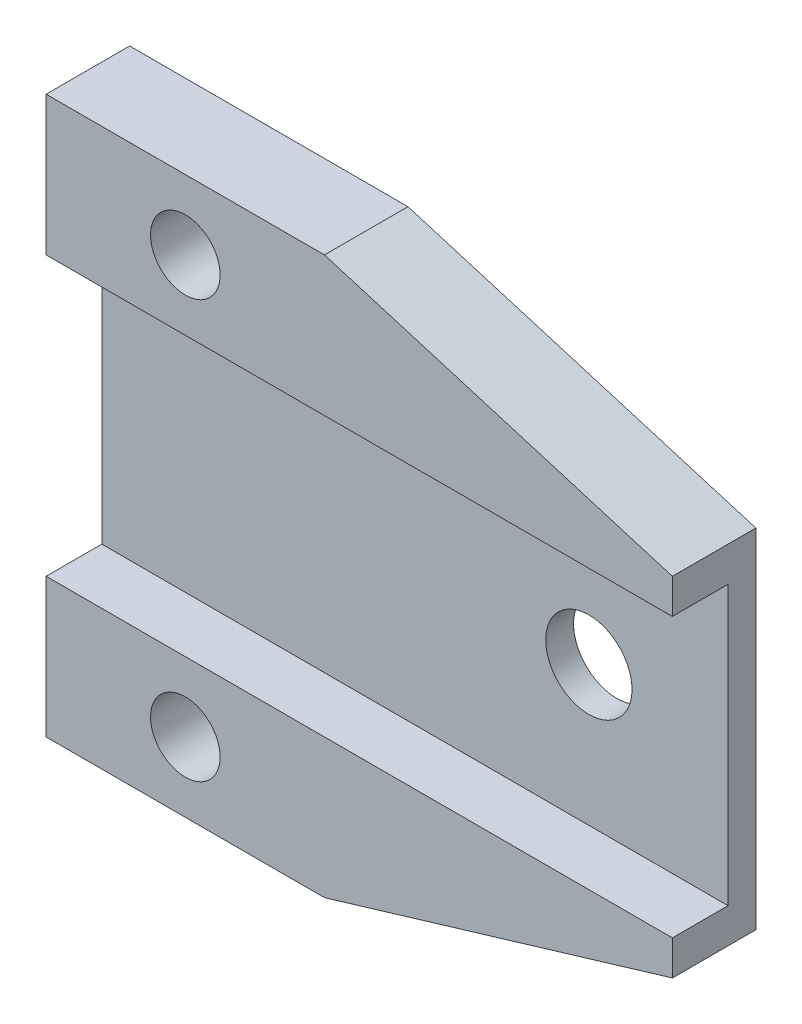
from build123d import *

# Parameters (mm, degrees)
SKETCH1_R           = 2.5
BOSS_EXTRUDE1_DEPTH = 6
CUT_EXTRUDE1_REACH  = 51.608
SKETCH2_W           = 4
SKETCH2_H           = 20
CUT_EXTRUDE2_REACH  = 42.509
SKETCH3_R           = 3.1


with BuildPart() as part:
    # Sketch1 → Boss-Extrude1 (new body)
    with BuildSketch(Plane.XY):
        Polygon((10, 20), (35, 12.5), (35, -12.5), (10, -20), (-10, -20), (-10, 20), align=None)
        with Locations((0, -15)):
            Circle(SKETCH1_R, mode=Mode.SUBTRACT)
        with Locations((0, 15)):
            Circle(SKETCH1_R, mode=Mode.SUBTRACT)
    extrude(amount=BOSS_EXTRUDE1_DEPTH)

    # Sketch2 → Cut-Extrude1 (cut, up to next)
    with BuildSketch(Plane(origin=(35, 0, 0), x_dir=(0, 0, -1), z_dir=(1, 0, 0)), mode=Mode.PRIVATE) as cut_extrude1_sk1:
        with Locations((-4, 0)):
            Rectangle(SKETCH2_W, SKETCH2_H)
    cut_extrude1_tool1 = extrude(cut_extrude1_sk1.sketch, amount=-CUT_EXTRUDE1_REACH, mode=Mode.PRIVATE) & part.part
    add(cut_extrude1_tool1.solids().sort_by_distance((35, 0, 4))[0], mode=Mode.SUBTRACT)

    # Sketch3 → Cut-Extrude2 (cut, up to next)
    with BuildSketch(Plane.XY.offset(2), mode=Mode.PRIVATE) as cut_extrude2_sk1:
        with Locations((25, 0)):
            Circle(SKETCH3_R)
    cut_extrude2_tool1 = extrude(cut_extrude2_sk1.sketch, amount=-CUT_EXTRUDE2_REACH, mode=Mode.PRIVATE) & part.part
    add(cut_extrude2_tool1.solids().sort_by_distance((25, 0, 2))[0], mode=Mode.SUBTRACT)


solid = part.part
